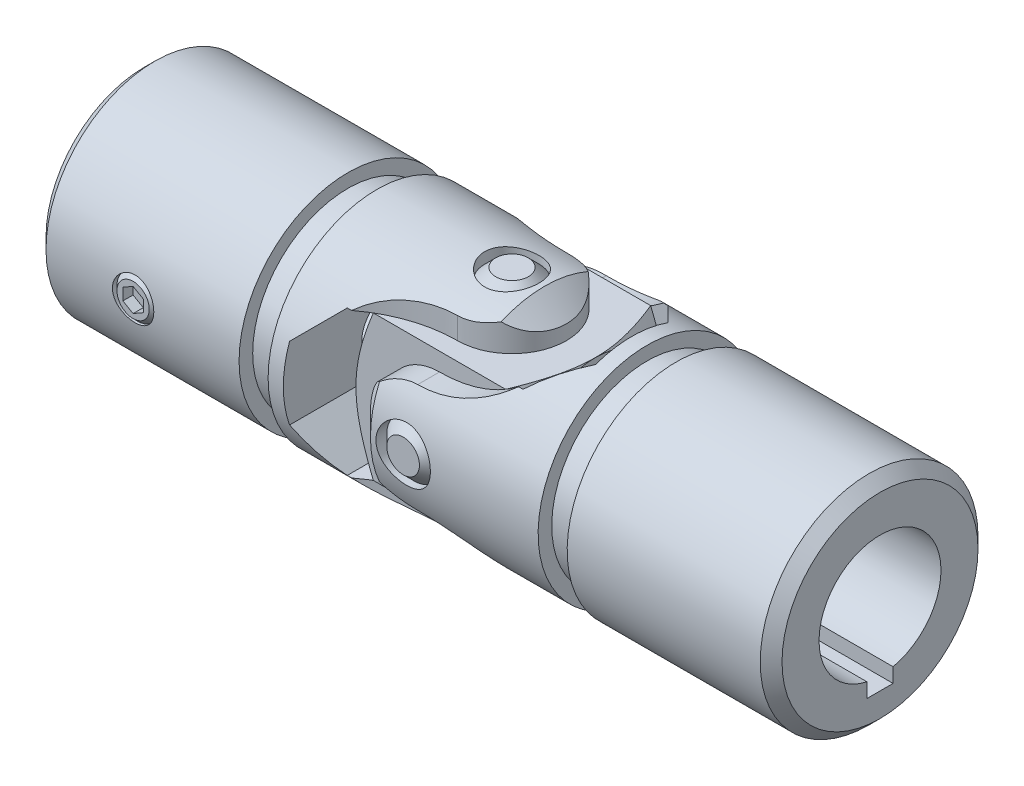
from build123d import *

# Parameters (mm, degrees)
CHAMFER1_SIZE               = 1.27
CHAMFER2_SIZE               = 2.54
EXTRUDE1_DEPTH              = 47.531940385
EXTRUDE1_DEPTH_BACK         = 47.531940385
EXTRUDE3_DEPTH              = 47.53194044
EXTRUDE3_DEPTH_BACK         = 47.53194044
SKETCH4_R                   = 7.112
EXTRUDE4_DEPTH              = 25.4
EXTRUDE6_DEPTH              = 47.53194044
EXTRUDE6_DEPTH_BACK         = 47.53194044
SKETCH6_R                   = 3.175
SKETCH7_W                   = 3.048
SKETCH7_H                   = 3.048
EXTRUDE7_DEPTH              = 25.4
SKETCH8_R                   = 2.413
EXTRUDE8_DEPTH              = 47.53194044
EXTRUDE9_DEPTH              = 1.190625
BODY_MOVE_COPY1_ANGLE       = 90
EXTRUDE10_REACH             = 48.532
SKETCH10_W                  = 19.4818
SKETCH10_H                  = 16.9164
EXTRUDE10_DIRECTION_2_REACH = 48.532
SKETCH11_OUTSIDE_W          = 242.238
SKETCH11_OUTSIDE_H          = 242.238
SKETCH11_OUTSIDE_R          = 8.4582
EXTRUDE11_DEPTH             = 56.645146879
EXTRUDE11_DRAFT             = -60
SKETCH12_OUTSIDE_W          = 270.531
SKETCH12_OUTSIDE_H          = 270.53
SKETCH12_OUTSIDE_R          = 8.4582
EXTRUDE12_DEPTH             = 64.812456603
EXTRUDE12_DRAFT             = 60
EXTRUDE13_DEPTH             = 47.531940532
EXTRUDE13_DEPTH_BACK        = 47.531940532
SKETCH13_R                  = 3.175
SKETCH14_R                  = 3.175
EXTRUDE14_DEPTH             = 12.7
EXTRUDE15_DEPTH             = 47.531940532
EXTRUDE15_DEPTH_BACK        = 47.531940532
SKETCH15_R                  = 3.175
SKETCH16_R                  = 3.175
EXTRUDE16_DEPTH             = 12.7
CHAMFER3_SIZE               = 1.27


with BuildPart() as part:
    # Sketch1 → Revolve1 (revolve)
    with BuildSketch(Plane(origin=(0, 0, 0), x_dir=(1, 0, 0), z_dir=(0, 1, 0)), mode=Mode.PRIVATE) as revolve1_sk:
        Polygon((-42.926, 12.7), (-19.135725, 12.7), (-19.135725, 11.1125), (-15.748, 11.1125), (-15.748, 12.7), (6.35, 12.7), (6.35, 0), (-42.926, 0), align=None)
    revolve(revolve1_sk.sketch.rotate(Axis((-42.926, 0, 0), (1, 0, 0)), 180), axis=Axis((-42.926, 0, 0), (1, 0, 0)))

    # Chamfer1
    chamfer1_edges = [part.edges().sort_by_distance(p)[0] for p in [
        (-42.926, 0, -12.7),
    ]]
    chamfer(chamfer1_edges, length=CHAMFER1_SIZE)

    # Chamfer2
    chamfer2_edges = [part.edges().sort_by_distance(p)[0] for p in [
        (6.35, 0, -12.7),
    ]]
    chamfer(chamfer2_edges, length=CHAMFER2_SIZE)

    # Sketch2 → Extrude1 (cut, two sides: drawn at the far end of the back side and taken through both)
    with BuildSketch(Plane(origin=(0, 0, 0), x_dir=(1, 0, 0), z_dir=(0, 1, 0)).offset(-EXTRUDE1_DEPTH_BACK)):
        with BuildLine():
            Line((-12.360275, 12.7), (12.7, 12.7))
            Line((12.7, 12.7), (12.7, -12.7))
            Line((12.7, -12.7), (-12.360275, -12.7))
            ThreePointArc((-12.360275, -12.7), (-6.948001477, -8.03035277), (0, -6.35))
            ThreePointArc((0, -6.35), (6.35, 0), (0, 6.35))
            ThreePointArc((0, 6.35), (-6.948001477, 8.03035277), (-12.360275, 12.7))
        make_face()
    extrude(amount=EXTRUDE1_DEPTH + EXTRUDE1_DEPTH_BACK, mode=Mode.SUBTRACT)

    # Sketch3 → Extrude3 (cut, two sides: drawn at the far end of the back side and taken through both)
    with BuildSketch(Plane.XY.offset(-EXTRUDE3_DEPTH_BACK)):
        Polygon((-9.7409, 8.4582), (-13.97, 4.2291), (-13.97, -4.2291), (-9.7409, -8.4582), (12.7, -8.4582), (12.7, 8.4582), align=None)
    extrude(amount=EXTRUDE3_DEPTH + EXTRUDE3_DEPTH_BACK, mode=Mode.SUBTRACT)

    # Sketch4 → Extrude4 (cut)
    with BuildSketch(Plane.ZY.offset(42.926)):
        Circle(SKETCH4_R)
    extrude(amount=-EXTRUDE4_DEPTH, mode=Mode.SUBTRACT)

    # Extrude5 cone 1 section (through the dimple's axis) → Extrude5 (revolve, cut)
    with BuildSketch(Plane(origin=(-17.526, 0, 0), x_dir=(0, 0, 1), z_dir=(0, 1, 0))):
        Polygon((0, 0), (7.112, 0), (0, 7.112), align=None)
    revolve(axis=Axis((-17.526, 0, 0), (1, 0, 0)), mode=Mode.SUBTRACT)

    # Sketch6 → Extrude6 (cut, two sides: drawn at the far end of the back side and taken through both)
    with BuildSketch(Plane(origin=(0, 0, 0), x_dir=(1, 0, 0), z_dir=(0, 1, 0)).offset(-EXTRUDE6_DEPTH_BACK)):
        with Locations(Location((0, 0, 0), (0, 0, 270))):
            Circle(SKETCH6_R)
    extrude(amount=EXTRUDE6_DEPTH + EXTRUDE6_DEPTH_BACK, mode=Mode.SUBTRACT)

    # Sketch7 → Extrude7 (cut)
    with BuildSketch(Plane.ZY.offset(42.926)):
        with Locations((7.112, 0)):
            Rectangle(SKETCH7_W, SKETCH7_H)
    extrude(amount=-EXTRUDE7_DEPTH, mode=Mode.SUBTRACT)

    # Sketch8 → Extrude8 (cut, through all)
    with BuildSketch(Plane.XY):
        with Locations(Location((-31.496, 0, 0), (0, 0, 180))):
            Circle(SKETCH8_R)
    extrude(amount=EXTRUDE8_DEPTH, mode=Mode.SUBTRACT)


with BuildPart() as body_2:
    # Sketch17 → Revolve2 (revolve)
    with BuildSketch(Plane(origin=(0, 0, 0), x_dir=(1, 0, 0), z_dir=(0, 1, 0)), mode=Mode.PRIVATE) as revolve2_sk:
        Polygon((-31.496, -12.7), (-29.612166667, -12.7), (-29.083, -12.170833333), (-29.083, -8.995833333), (-30.141333333, -7.9375), (-30.6705, -7.9375), (-31.496, -8.763), align=None)
    revolve(revolve2_sk.sketch.rotate(Axis((-31.496, 0, 0), (0, 0, 1)), 180), axis=Axis((-31.496, 0, 0), (0, 0, 1)))

    # Sketch9 → Extrude9 (cut)
    with BuildSketch(Plane.XY.offset(12.7)):
        Polygon((-31.496, 1.374815329), (-32.686625, 0.687407664), (-32.686625, -0.687407664), (-31.496, -1.374815329), (-30.305375, -0.687407664), (-30.305375, 0.687407664), align=None)
    extrude(amount=-EXTRUDE9_DEPTH, mode=Mode.SUBTRACT)


with BuildPart() as body_3:
    # Mirror1: mirrored copy
    add(part.part.mirror(Plane(origin=(0, 0, 0), x_dir=(0, 0, 1), z_dir=(1, 0, 0))))


with BuildPart() as body_4:
    # Mirror1 2: mirrored copy
    add(body_2.part.mirror(Plane(origin=(0, 0, 0), x_dir=(0, 0, 1), z_dir=(1, 0, 0))))


with BuildPart() as body_3_1:
    # Body-Move/Copy1: moved
    add(body_3.part.rotate(Axis((0, 0, 0), (1, 0, 0)), BODY_MOVE_COPY1_ANGLE))


with BuildPart() as body_4_1:
    # Body-Move/Copy1: moved
    add(body_4.part.rotate(Axis((0, 0, 0), (1, 0, 0)), BODY_MOVE_COPY1_ANGLE))


with BuildPart() as body_5:

    # Extrude10: up to this face of the body (flat: up to its plane)
    extrude10_end = Plane(body_3_1.part.faces().sort_by_distance((3.334992848, 0, -8.4582))[0])
    # Sketch10 → Extrude10 (new, up to the picked face)
    with BuildSketch(Plane.XY, mode=Mode.PRIVATE) as extrude10_sk1:
        Rectangle(SKETCH10_W, SKETCH10_H)
    extrude10_tool1 = split(extrude(extrude10_sk1.sketch, amount=-EXTRUDE10_REACH, mode=Mode.PRIVATE), bisect_by=extrude10_end, keep=Keep.BOTH, mode=Mode.PRIVATE)
    add(extrude10_tool1.solids().sort_by(Axis((0, 0, 0), (0, 0, -1)))[0])


    # Extrude10 direction 2: up to this face of the body (flat: up to its plane)
    extrude10_direction_2_end = Plane(body_3_1.part.faces().sort_by_distance((3.334992848, 0, 8.4582))[0])
    # Sketch10 → Extrude10 direction 2 (add, up to the picked face)
    with BuildSketch(Plane.XY, mode=Mode.PRIVATE) as extrude10_direction_2_sk1:
        Rectangle(SKETCH10_W, SKETCH10_H)
    extrude10_direction_2_tool1 = split(extrude(extrude10_direction_2_sk1.sketch, amount=EXTRUDE10_DIRECTION_2_REACH, mode=Mode.PRIVATE), bisect_by=extrude10_direction_2_end, keep=Keep.BOTH, mode=Mode.PRIVATE)
    add(extrude10_direction_2_tool1.solids().sort_by(Axis((0, 0, 0), (0, 0, 1)))[0])


with BuildPart() as extrude11_tool:
    # Sketch11 outside → Extrude11 (with draft: the straight prism first)
    with BuildSketch(Plane(origin=(9.7409, 0, 0), x_dir=(0, 0, -1), z_dir=(1, 0, 0))):
        Rectangle(SKETCH11_OUTSIDE_W, SKETCH11_OUTSIDE_H)
        Circle(SKETCH11_OUTSIDE_R, mode=Mode.SUBTRACT)
    extrude(amount=-EXTRUDE11_DEPTH)
    # Extrude11: the draft: its side faces are tilted about the plane it starts from
    extrude11_sides = [extrude11_tool.faces().sort_by_distance(p)[0] for p in [
        (-18.58167344, -121.119, 0),
        (-18.58167344, 0, -121.119),
        (-18.58167344, 121.119, 0),
        (-18.58167344, 0, 121.119),
        (-18.58167344, 0, 8.4582),
    ]]
    draft(extrude11_sides, Plane(origin=(9.7409, 0, 0), x_dir=(0, 0, -1), z_dir=(1, 0, 0)), EXTRUDE11_DRAFT)


with BuildPart() as body_5_1:
    add(body_5.part)

    # Extrude11: cut by extrude11_tool
    add(extrude11_tool.part, mode=Mode.SUBTRACT)


with BuildPart() as extrude12_tool:
    # Sketch12 outside → Extrude12 (with draft: the straight prism first)
    with BuildSketch(Plane(origin=(-9.7409, -21.0185, 0), x_dir=(0, -1, 0), z_dir=(1, 0, 0))):
        with Locations((-21.0185, 0)):
            Rectangle(SKETCH12_OUTSIDE_W, SKETCH12_OUTSIDE_H)
        with Locations((-21.0185, 0)):
            Circle(SKETCH12_OUTSIDE_R, mode=Mode.SUBTRACT)
    extrude(amount=EXTRUDE12_DEPTH)
    # Extrude12: the draft: its side faces are tilted about the plane it starts from
    extrude12_sides = [extrude12_tool.faces().sort_by_distance(p)[0] for p in [
        (22.665328301, 0, 135.265),
        (22.665328301, -135.2655, 0),
        (22.665328301, 0, -135.265),
        (22.665328301, 135.2655, 0),
        (22.665328301, 8.4582, 0),
    ]]
    draft(extrude12_sides, Plane(origin=(-9.7409, -21.0185, 0), x_dir=(0, -1, 0), z_dir=(1, 0, 0)), EXTRUDE12_DRAFT)


with BuildPart() as body_5_2:
    add(body_5_1.part)

    # Extrude12: cut by extrude12_tool
    add(extrude12_tool.part, mode=Mode.SUBTRACT)

    # Sketch13 → Extrude13 (cut, two sides: drawn at the far end of the back side and taken through both)
    with BuildSketch(Plane(origin=(0, 0, 0), x_dir=(1, 0, 0), z_dir=(0, 1, 0)).offset(-EXTRUDE13_DEPTH_BACK)):
        with Locations(Location((0, 0, 0), (0, 0, 180))):
            Circle(SKETCH13_R)
    extrude(amount=EXTRUDE13_DEPTH + EXTRUDE13_DEPTH_BACK, mode=Mode.SUBTRACT)

    # Sketch15 → Extrude15 (cut, two sides: drawn at the far end of the back side and taken through both)
    with BuildSketch(Plane.XY.offset(-EXTRUDE15_DEPTH_BACK)):
        Circle(SKETCH15_R)
    extrude(amount=EXTRUDE15_DEPTH + EXTRUDE15_DEPTH_BACK, mode=Mode.SUBTRACT)


with BuildPart() as body_6:
    # Sketch14 → Extrude14 (new, symmetric)
    with BuildSketch(Plane(origin=(0, 0, 0), x_dir=(1, 0, 0), z_dir=(0, 1, 0))):
        with Locations(Location((0, 0, 0), (0, 0, 270))):
            Circle(SKETCH14_R)
    extrude(amount=EXTRUDE14_DEPTH, both=True)

    # Sketch16 → Extrude16 (add, symmetric)
    with BuildSketch(Plane.XY):
        Circle(SKETCH16_R)
    extrude(amount=EXTRUDE16_DEPTH, both=True)

    # Chamfer3
    chamfer3_edges = [body_6.edges().sort_by_distance(p)[0] for p in [
        (0, -12.7, -3.175),
        (0, 12.7, -3.175),
        (-3.175, 0, -12.7),
        (-3.175, 0, 12.7),
    ]]
    chamfer(chamfer3_edges, length=CHAMFER3_SIZE)


solid = Compound([part.part, body_2.part, body_3_1.part, body_4_1.part, body_5_2.part, body_6.part])
